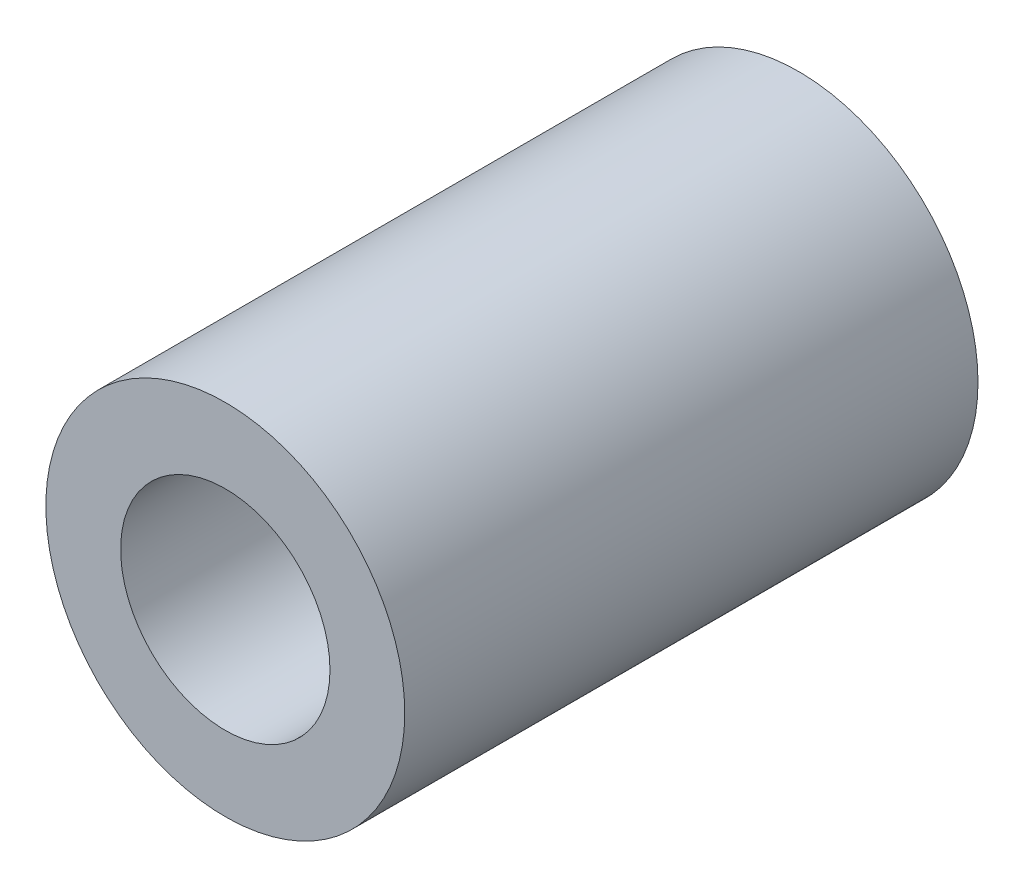
from build123d import *

# Parameters (mm, degrees)
ESQUISSE1_R        = 3.6
ESQUISSE1_R_2      = 2.1
BOSS_EXTRU_1_DEPTH = 11.5


with BuildPart() as part:
    # Esquisse1 → Boss.-Extru.1 (new body)
    with BuildSketch(Plane.XY):
        Circle(ESQUISSE1_R)
        Circle(ESQUISSE1_R_2, mode=Mode.SUBTRACT)
    extrude(amount=BOSS_EXTRU_1_DEPTH)


solid = part.part
